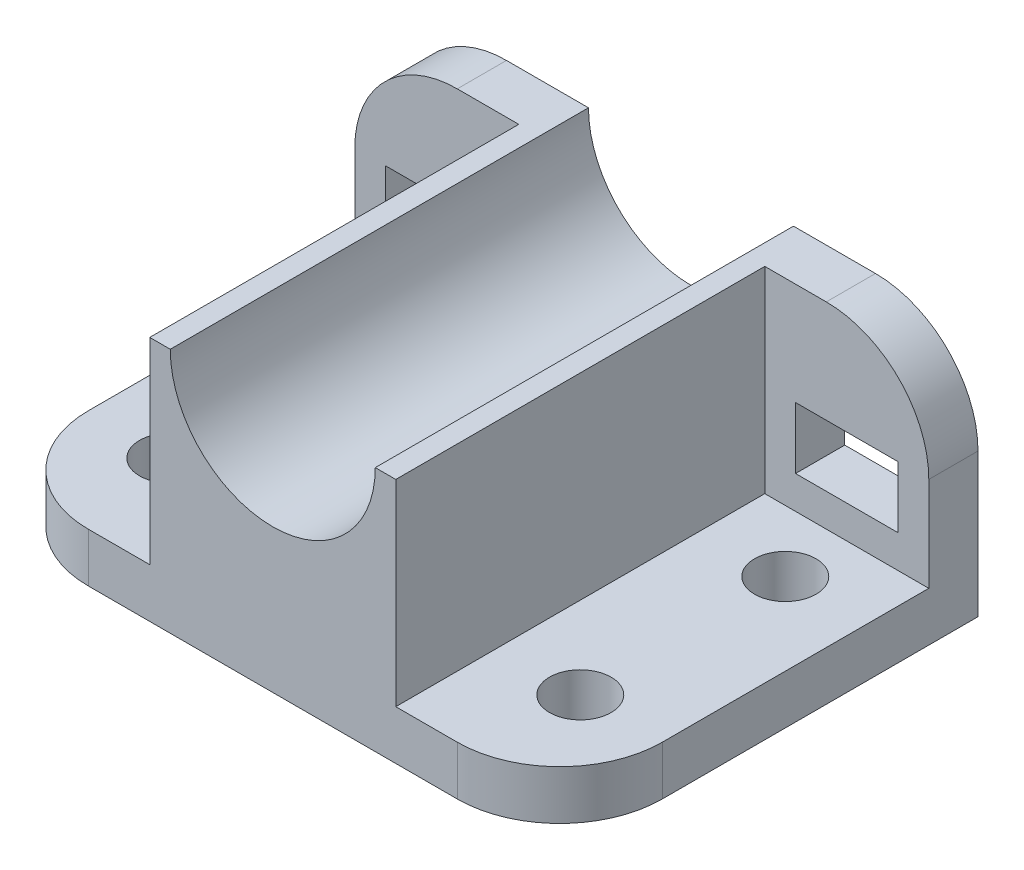
from build123d import *

# Parameters (mm, degrees)
BOSS_EXTRUDE1_DEPTH = 102
SKETCH2_W           = 40
SKETCH2_H           = 48
CUT_EXTRUDE1_DEPTH  = 90
FILLET1_R           = 25
FILLET2_R           = 25
SKETCH3_W           = 25
SKETCH3_H           = 15
CUT_EXTRUDE2_DEPTH  = 90
HOLE1_D             = 15


with BuildPart() as part:
    # Sketch1 → Boss-Extrude1 (new body)
    with BuildSketch(Plane.XY):
        with BuildLine():
            Line((-70, 0), (70, 0))
            Line((70, 0), (70, 60))
            Line((70, 60), (25, 60))
            ThreePointArc((25, 60), (0, 35), (-25, 60))
            Line((-25, 60), (-70, 60))
            Line((-70, 60), (-70, 0))
        make_face()
    extrude(amount=BOSS_EXTRUDE1_DEPTH)

    # Sketch2 → Cut-Extrude1 (cut)
    with BuildSketch(Plane.XY.offset(102)):
        with Locations((50, 36)):
            Rectangle(SKETCH2_W, SKETCH2_H)
    cut_extrude1 = extrude(amount=-CUT_EXTRUDE1_DEPTH, mode=Mode.SUBTRACT)

    # Mirror1: Cut-Extrude1 across plane
    add(cut_extrude1.mirror(Plane(origin=(0, 0, 0), x_dir=(0, 0, 1), z_dir=(1, 0, 0))), mode=Mode.SUBTRACT)

    # Fillet1
    fillet1_edges = [part.edges().sort_by_distance(p)[0] for p in [
        (70, 60, 6),
        (-70, 60, 6),
    ]]
    fillet(fillet1_edges, radius=FILLET1_R)

    # Fillet2
    fillet2_edges = [part.edges().sort_by_distance(p)[0] for p in [
        (70, 6, 102),
        (-70, 6, 102),
    ]]
    fillet(fillet2_edges, radius=FILLET2_R)

    # Sketch3 → Cut-Extrude2 (cut)
    with BuildSketch(Plane.XY.offset(12)):
        with Locations((50, 27.5)):
            Rectangle(SKETCH3_W, SKETCH3_H)
    cut_extrude2 = extrude(amount=-CUT_EXTRUDE2_DEPTH, mode=Mode.SUBTRACT)

    # Mirror2: Cut-Extrude2 across plane
    add(cut_extrude2.mirror(Plane(origin=(0, 0, 0), x_dir=(0, 0, 1), z_dir=(1, 0, 0))), mode=Mode.SUBTRACT)

    # Hole1 (through all)
    with Locations(Plane(origin=(0, 12, 0), x_dir=(1, 0, 0), z_dir=(0, 1, 0))):
        with Locations((50, -77), (50, -27), (-50, -27), (-50, -77)):
            Hole(HOLE1_D / 2)


solid = part.part
